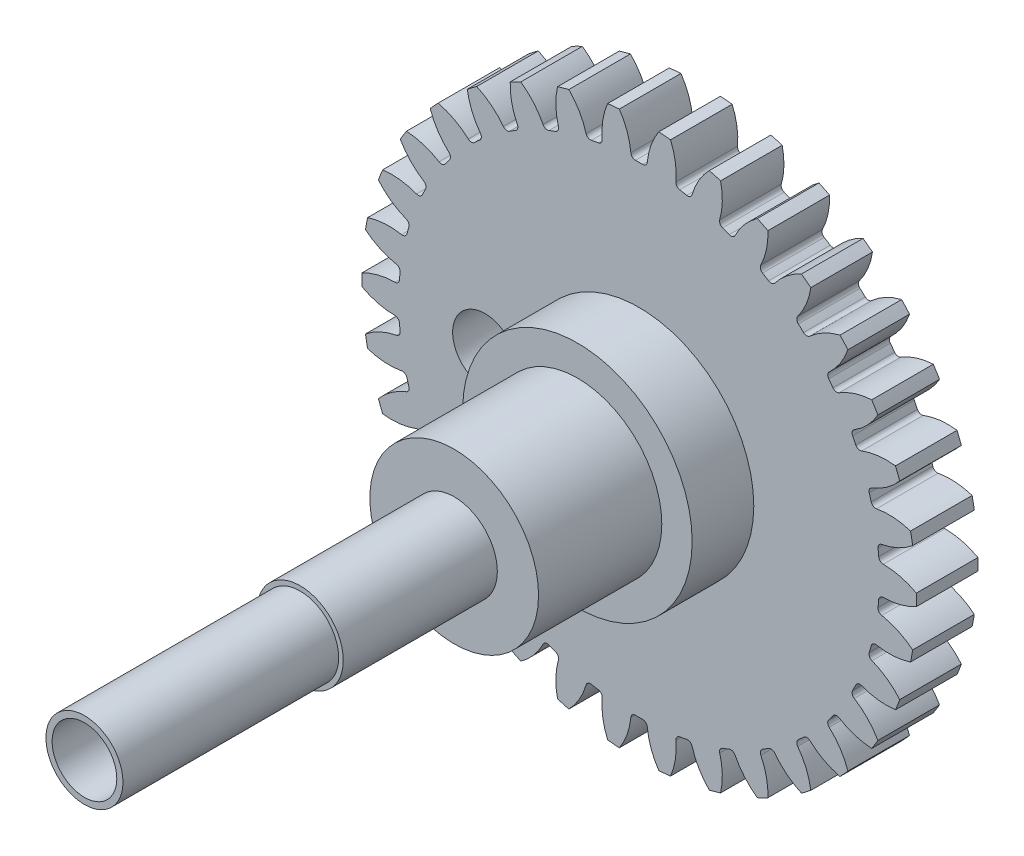
from build123d import *

# Parameters (mm, degrees)
SKETCH1_R                = 9
BOSS_EXTRUDE1_DEPTH      = 1
CUT_EXTRUDE1_DEPTH       = 13.767145335
FILLET1_R                = 0.15
CIRPATTERN1_COUNT        = 34
FILLET1_OF_CIRPATTERN1_R = 0.15
CUT_EXTRUDE2_DEPTH       = 13.868196522
CUT_EXTRUDE2_DEPTH_BACK  = 13.868196522
SKETCH4_R                = 1.05
SKETCH5_R                = 1.05
CUT_EXTRUDE3_DEPTH       = 10
SKETCH6_R                = 3.723386592
BOSS_EXTRUDE2_DEPTH      = 2
SKETCH7_R                = 2.737690205
BOSS_EXTRUDE3_DEPTH      = 4
SKETCH8_R                = 1.4
BOSS_EXTRUDE4_DEPTH      = 5
SKETCH9_R                = 1.25
BOSS_EXTRUDE5_DEPTH      = 7
SKETCH10_R               = 1.05
CUT_EXTRUDE4_DEPTH       = 23.036117656


with BuildPart() as part:
    # Sketch1 → Boss-Extrude1 (new, symmetric)
    with BuildSketch(Plane.XY):
        Circle(SKETCH1_R)
    extrude(amount=BOSS_EXTRUDE1_DEPTH, both=True)

    # Sketch3 → Cut-Extrude1 (cut, symmetric)
    with BuildSketch(Plane.XY):
        with BuildLine():
            ThreePointArc((0.258080034, 7.79572926), (0, 7.8), (-0.258080034, 7.79572926))
            ThreePointArc((-0.258080034, 7.79572926), (-0.365908032, 8.413333141), (-0.639939263, 8.977219934))
            ThreePointArc((-0.639939263, 8.977219934), (0, 9), (0.639939263, 8.977219934))
            ThreePointArc((0.639939263, 8.977219934), (0.365908032, 8.413333141), (0.258080034, 7.79572926))
        make_face()
    cut_extrude1 = extrude(amount=CUT_EXTRUDE1_DEPTH, both=True, mode=Mode.SUBTRACT)

    # Fillet1
    fillet1_edges = [part.edges().sort_by_distance(p)[0] for p in [
        (0.258080034, 7.79572926, 0),
        (-0.258080034, 7.79572926, 0),
    ]]
    fillet(fillet1_edges, radius=FILLET1_R)

    # CirPattern1: Cut-Extrude1 ×34 about axis
    cirpattern1_axis = Axis((0, 0, 0), (0, 0, 1))
    for i in range(1, CIRPATTERN1_COUNT):
        add(cut_extrude1.rotate(cirpattern1_axis, i * 360 / CIRPATTERN1_COUNT), mode=Mode.SUBTRACT)

    # Fillet1 of CirPattern1
    fillet1_of_cirpattern1_edges = [part.edges().sort_by_distance(p)[0] for p in [
        (-1.178775761, 7.710414237, 0),
        (-1.686147224, 7.615570073, 0),
        (-2.575489762, 7.362530305, 0),
        (-3.056794692, 7.176071781, 0),
        (-3.884498548, 6.763924233, 0),
        (-4.323346683, 6.492200972, 0),
        (-5.061225395, 5.934980834, 0),
        (-5.442672288, 5.587246045, 0),
        (-6.065598281, 4.903928781, 0),
        (-6.376654216, 4.492024154, 0),
        (-6.863414493, 3.705879315, 0),
        (-7.093486833, 3.243831769, 0),
        (-7.427505356, 2.381630574, 0),
        (-7.568759263, 1.885174584, 0),
        (-7.738661432, 0.97627826, 0),
        (-7.786286675, 0.462320039, 0),
        (-7.786286675, -0.462320039, 0),
        (-7.738661432, -0.97627826, 0),
        (-7.568759263, -1.885174584, 0),
        (-7.427505356, -2.381630574, 0),
        (-7.093486833, -3.243831769, 0),
        (-6.863414493, -3.705879315, 0),
        (-6.376654216, -4.492024154, 0),
        (-6.065598281, -4.903928781, 0),
        (-5.442672288, -5.587246045, 0),
        (-5.061225395, -5.934980834, 0),
        (-4.323346683, -6.492200972, 0),
        (-3.884498548, -6.763924233, 0),
        (-3.056794692, -7.176071781, 0),
        (-2.575489762, -7.362530305, 0),
        (-1.686147224, -7.615570073, 0),
        (-1.178775761, -7.710414237, 0),
        (-0.258080034, -7.79572926, 0),
        (0.258080034, -7.79572926, 0),
        (1.178775761, -7.710414237, 0),
        (1.686147224, -7.615570073, 0),
        (2.575489762, -7.362530305, 0),
        (3.056794692, -7.176071781, 0),
        (3.884498548, -6.763924233, 0),
        (4.323346683, -6.492200972, 0),
        (5.061225395, -5.934980834, 0),
        (5.442672288, -5.587246045, 0),
        (6.065598281, -4.903928781, 0),
        (6.376654216, -4.492024154, 0),
        (6.863414493, -3.705879315, 0),
        (7.093486833, -3.243831769, 0),
        (7.427505356, -2.381630574, 0),
        (7.568759263, -1.885174584, 0),
        (7.738661432, -0.97627826, 0),
        (7.786286675, -0.462320039, 0),
        (7.786286675, 0.462320039, 0),
        (7.738661432, 0.97627826, 0),
        (7.568759263, 1.885174584, 0),
        (7.427505356, 2.381630574, 0),
        (7.093486833, 3.243831769, 0),
        (6.863414493, 3.705879315, 0),
        (6.376654216, 4.492024154, 0),
        (6.065598281, 4.903928781, 0),
        (5.442672288, 5.587246045, 0),
        (5.061225395, 5.934980834, 0),
        (4.323346683, 6.492200972, 0),
        (3.884498548, 6.763924233, 0),
        (3.056794692, 7.176071781, 0),
        (2.575489762, 7.362530305, 0),
        (1.686147224, 7.615570073, 0),
        (1.178775761, 7.710414237, 0),
    ]]
    fillet(fillet1_of_cirpattern1_edges, radius=FILLET1_OF_CIRPATTERN1_R)

    # Sketch4 → Cut-Extrude2 (cut, two sides: drawn at the far end of the back side and taken through both)
    with BuildSketch(Plane.XY.offset(1).offset(-CUT_EXTRUDE2_DEPTH_BACK)):
        Circle(SKETCH4_R)
    extrude(amount=CUT_EXTRUDE2_DEPTH + CUT_EXTRUDE2_DEPTH_BACK, mode=Mode.SUBTRACT)

    # Sketch5 → Cut-Extrude3 (cut)
    with BuildSketch(Plane.XY.offset(1)):
        with Locations((-5, 0)):
            Circle(SKETCH5_R)
    extrude(amount=-CUT_EXTRUDE3_DEPTH, mode=Mode.SUBTRACT)

    # Sketch6 → Boss-Extrude2 (add)
    with BuildSketch(Plane.XY.offset(1)):
        Circle(SKETCH6_R)
    extrude(amount=BOSS_EXTRUDE2_DEPTH)

    # Sketch7 → Boss-Extrude3 (add)
    with BuildSketch(Plane.XY.offset(3)):
        Circle(SKETCH7_R)
    extrude(amount=BOSS_EXTRUDE3_DEPTH)

    # Sketch8 → Boss-Extrude4 (add)
    with BuildSketch(Plane.XY.offset(7)):
        Circle(SKETCH8_R)
    extrude(amount=BOSS_EXTRUDE4_DEPTH)

    # Sketch9 → Boss-Extrude5 (add)
    with BuildSketch(Plane.XY.offset(12)):
        Circle(SKETCH9_R)
    extrude(amount=BOSS_EXTRUDE5_DEPTH)

    # Sketch10 → Cut-Extrude4 (cut, through all)
    with BuildSketch(Plane(origin=(0, 0, 1), x_dir=(-1, 0, 0), z_dir=(0, 0, -1))):
        with Locations(Location((0, 0, 0), (0, 0, 180))):
            Circle(SKETCH10_R)
    extrude(amount=-CUT_EXTRUDE4_DEPTH, mode=Mode.SUBTRACT)


solid = part.part
